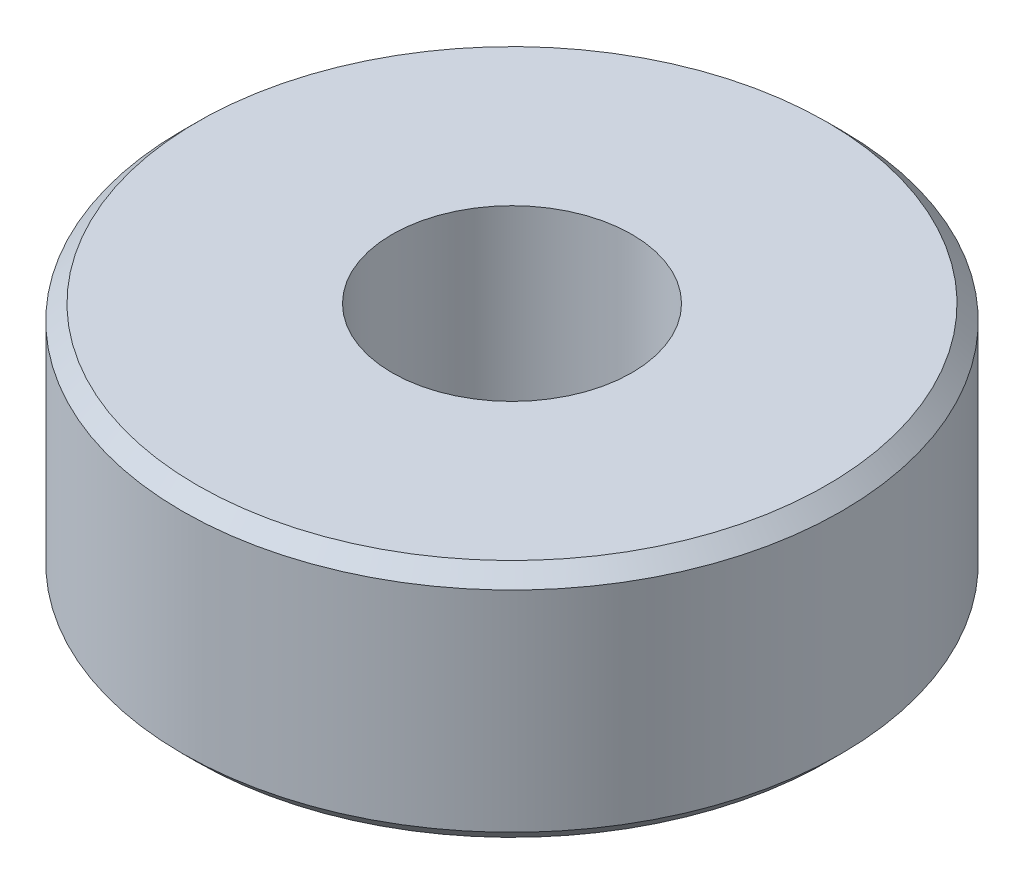
from build123d import *

# Parameters (mm, degrees)
SKETCH1_R           = 11
SKETCH1_R_2         = 4
BOSS_EXTRUDE1_DEPTH = 8
CHAMFER1_SIZE       = 0.5


with BuildPart() as part:
    # Sketch1 → Boss-Extrude1 (new body)
    with BuildSketch(Plane(origin=(0, 0, 0), x_dir=(1, 0, 0), z_dir=(0, 1, 0))):
        with Locations(Location((0, 0, 0), (0, 0, 270))):
            Circle(SKETCH1_R)
        with Locations(Location((0, 0, 0), (0, 0, 270))):
            Circle(SKETCH1_R_2, mode=Mode.SUBTRACT)
    extrude(amount=BOSS_EXTRUDE1_DEPTH)

    # Chamfer1
    chamfer1_edges = [part.edges().sort_by_distance(p)[0] for p in [
        (0, 0, -11),
        (0, 8, -11),
        (0, 0, -4),
    ]]
    chamfer(chamfer1_edges, length=CHAMFER1_SIZE)


solid = part.part
